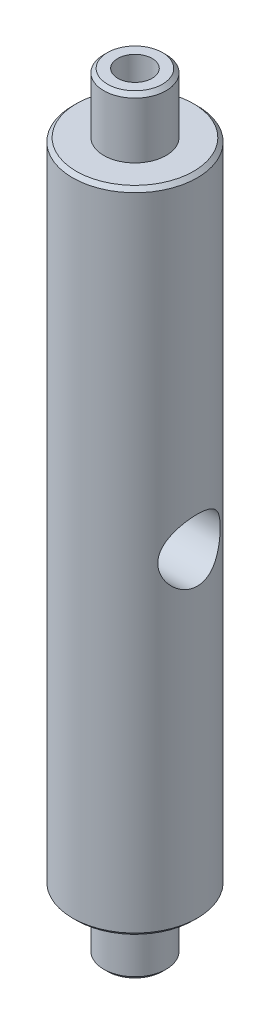
from build123d import *

# Parameters (mm, degrees)
SKETCH1_R                     = 6.35
MAIN_BODY_BOSS_EXTRUDE1_DEPTH = 66.04
SKETCH2_R                     = 3.175
TENDON_1_BOSS_EXTRUDE2_DEPTH  = 6.096
TENDON_START                  = 6.096
SKETCH3_R                     = 3.175
TENDON_2_BOSS_EXTRUDE3_DEPTH  = 6.096
SKETCH4_R                     = 1.7526
F_10_32_CUT_EXTRUDE1_DEPTH    = 11.176
F_10_32_START                 = -11.176
SKETCH5_R                     = 1.7526
F_10_32_CUT_EXTRUDE2_DEPTH    = 11.176
CHAMFER1_SIZE                 = 0.381
CUT_EXTRUDE3_DEPTH            = 73.692829743
CUT_EXTRUDE3_DEPTH_BACK       = 73.692829743
SKETCH6_R                     = 3.175


with BuildPart() as part:
    # Sketch1 → Main Body Boss-Extrude1 (new body)
    with BuildSketch(Plane(origin=(0, 0, 0), x_dir=(1, 0, 0), z_dir=(0, 1, 0))):
        with Locations(Location((0, 0, 0), (0, 0, 270))):
            Circle(SKETCH1_R)
    extrude(amount=MAIN_BODY_BOSS_EXTRUDE1_DEPTH)

    # Sketch2 → Tendon 1 Boss-Extrude2 (add)
    with BuildSketch(Plane.XZ):
        with Locations(Location((0, 0, 0), (0, 0, 90))):
            Circle(SKETCH2_R)
    extrude(amount=TENDON_1_BOSS_EXTRUDE2_DEPTH)

    # Sketch3 → Tendon 2 Boss-Extrude3 (add)
    with BuildSketch(Plane(origin=(0, 66.04, 0), x_dir=(1, 0, 0), z_dir=(0, 1, 0)).offset(TENDON_START)):
        with Locations(Location((0, 0, 0), (0, 0, 270))):
            Circle(SKETCH3_R)
    extrude(amount=-TENDON_2_BOSS_EXTRUDE3_DEPTH)

    # Sketch4 → 10_32 Cut-Extrude1 (cut)
    with BuildSketch(Plane(origin=(0, 72.136, 0), x_dir=(1, 0, 0), z_dir=(0, 1, 0))):
        with Locations(Location((0, 0, 0), (0, 0, 270))):
            Circle(SKETCH4_R)
    extrude(amount=-F_10_32_CUT_EXTRUDE1_DEPTH, mode=Mode.SUBTRACT)

    # Sketch5 → 10_32 Cut-Extrude2 (cut)
    with BuildSketch(Plane.XZ.offset(6.096).offset(F_10_32_START)):
        with Locations(Location((0, 0, 0), (0, 0, 90))):
            Circle(SKETCH5_R)
    extrude(amount=F_10_32_CUT_EXTRUDE2_DEPTH, mode=Mode.SUBTRACT)

    # Chamfer1
    chamfer1_edges = [part.edges().sort_by_distance(p)[0] for p in [
        (0, 72.136, -3.175),
        (0, 0, -6.35),
        (0, 66.04, -6.35),
        (0, -6.096, -3.175),
    ]]
    chamfer(chamfer1_edges, length=CHAMFER1_SIZE)

    # Sketch6 → Cut-Extrude3 (cut, two sides: drawn at the far end of the back side and taken through both)
    with BuildSketch(Plane(origin=(0, 0, 0), x_dir=(0, 0, -1), z_dir=(1, 0, 0)).offset(-CUT_EXTRUDE3_DEPTH_BACK)):
        with Locations((0, 32.8295)):
            Circle(SKETCH6_R)
    extrude(amount=CUT_EXTRUDE3_DEPTH + CUT_EXTRUDE3_DEPTH_BACK, mode=Mode.SUBTRACT)


solid = part.part
